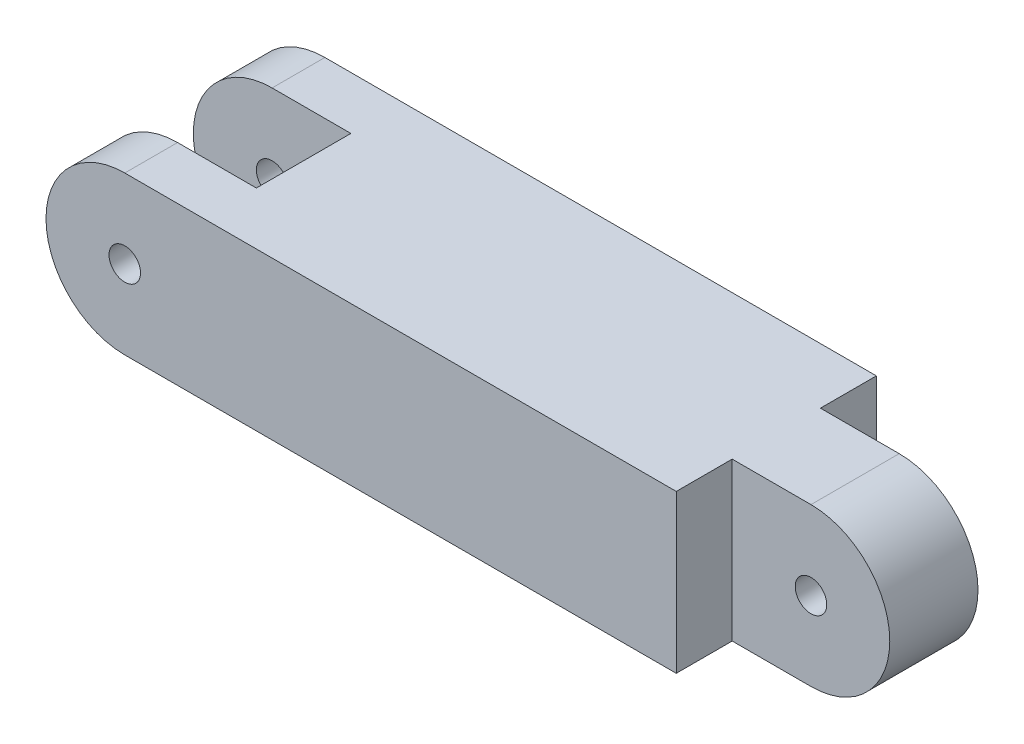
from build123d import *

# Parameters (mm, degrees)
BOSS_EXTRUDE1_DEPTH = 6.35
SKETCH2_R           = 1
CUT_EXTRUDE1_DEPTH  = 12.7
CUT_EXTRUDE2_DEPTH  = 3.55
CUT_EXTRUDE3_START  = -6.35
CUT_EXTRUDE3_DEPTH  = 3


with BuildPart() as part:
    # Sketch1 → Boss-Extrude1 (new, symmetric)
    with BuildSketch(Plane.XY):
        with BuildLine():
            Line((0, 5), (40, 5))
            ThreePointArc((40, 5), (45, 0), (40, -5))
            Line((40, -5), (0, -5))
            ThreePointArc((0, -5), (-5, 0), (0, 5))
        make_face()
    extrude(amount=BOSS_EXTRUDE1_DEPTH, both=True)

    # Sketch2 → Cut-Extrude1 (cut)
    with BuildSketch(Plane.XY.offset(6.35)):
        with Locations((40, 0)):
            Circle(SKETCH2_R)
        Circle(SKETCH2_R)
    extrude(amount=-CUT_EXTRUDE1_DEPTH, mode=Mode.SUBTRACT)

    # Sketch3 → Cut-Extrude2 (cut)
    with BuildSketch(Plane.XY.offset(6.35)):
        with BuildLine():
            Line((35, 5), (35, -5))
            Line((35, -5), (40, -5))
            ThreePointArc((40, -5), (45, 0), (40, 5))
            Line((40, 5), (35, 5))
        make_face()
    cut_extrude2 = extrude(amount=-CUT_EXTRUDE2_DEPTH, mode=Mode.SUBTRACT)

    # Mirror1: Cut-Extrude2 across plane
    add(cut_extrude2.mirror(Plane.XY), mode=Mode.SUBTRACT)

    # Sketch4 → Cut-Extrude3 (cut, symmetric)
    with BuildSketch(Plane.XY.offset(6.35).offset(CUT_EXTRUDE3_START)):
        with BuildLine():
            Line((5, 5), (5, -5))
            Line((5, -5), (0, -5))
            ThreePointArc((0, -5), (-5, 0), (0, 5))
            Line((0, 5), (5, 5))
        make_face()
    extrude(amount=CUT_EXTRUDE3_DEPTH, both=True, mode=Mode.SUBTRACT)


solid = part.part
